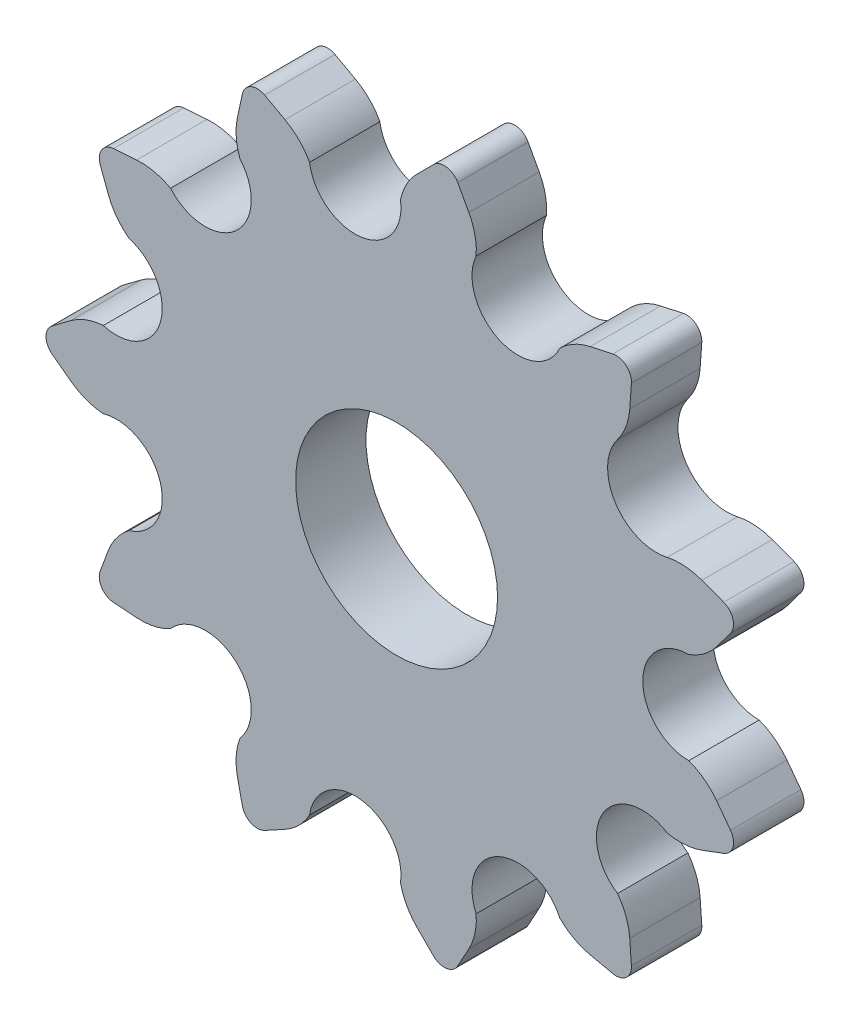
from build123d import *

# Parameters (mm, degrees)
SKETCH1_R           = 4.191
BOSS_EXTRUDE1_DEPTH = 2.921


with BuildPart() as part:
    # Sketch1 → Boss-Extrude1 (new body)
    with BuildSketch(Plane.XY):
        with BuildLine():
            Line((8.037087805, 10.932568983), (8.977813448, 11.137211321))
            ThreePointArc((8.977813448, 11.137211321), (9.528628972, 10.996624041), (9.746174499, 10.471422679))
            Line((9.746174499, 10.471422679), (9.677494343, 9.511148627))
            ThreePointArc((9.677494343, 9.511148627), (9.521666859, 8.798964182), (9.169962135, 8.160377715))
            ThreePointArc((9.169962135, 8.160377715), (9.081331887, 5.836217624), (11.232280603, 4.95134754))
            ThreePointArc((11.232280603, 4.95134754), (11.959262708, 5.005991004), (12.671821542, 4.851884559))
            Line((12.671821542, 4.851884559), (13.573848312, 4.515445968))
            ThreePointArc((13.573848312, 4.515445968), (13.961216597, 4.099383066), (13.860282246, 3.539941575))
            Line((13.860282246, 3.539941575), (13.283341474, 2.769238931))
            ThreePointArc((13.283341474, 2.769238931), (12.767215072, 2.254357949), (12.126096321, 1.907290757))
            ThreePointArc((12.126096321, 1.907290757), (10.218805564, 0), (12.126096321, -1.907290757))
            ThreePointArc((12.126096321, -1.907290757), (12.767215072, -2.254357949), (13.283341474, -2.769238931))
            Line((13.283341474, -2.769238931), (13.860282246, -3.539941575))
            ThreePointArc((13.860282246, -3.539941575), (13.961216597, -4.099383066), (13.573848312, -4.515445968))
            Line((13.573848312, -4.515445968), (12.671821542, -4.851884559))
            ThreePointArc((12.671821542, -4.851884559), (11.959262708, -5.005991004), (11.232280603, -4.95134754))
            ThreePointArc((11.232280603, -4.95134754), (8.596606282, -5.524703393), (9.169962135, -8.160377715))
            ThreePointArc((9.169962135, -8.160377715), (9.521666859, -8.798964182), (9.677494343, -9.511148627))
            Line((9.677494343, -9.511148627), (9.746174499, -10.471422679))
            ThreePointArc((9.746174499, -10.471422679), (9.528628972, -10.996624041), (8.977813448, -11.137211321))
            Line((8.977813448, -11.137211321), (8.037087805, -10.932568983))
            ThreePointArc((8.037087805, -10.932568983), (7.354328934, -10.676973184), (6.772295158, -10.237967978))
            ThreePointArc((6.772295158, -10.237967978), (4.245045246, -9.295352495), (3.302429764, -11.822602407))
            ThreePointArc((3.302429764, -11.822602407), (3.253056696, -12.549961458), (2.999111137, -13.233335836))
            Line((2.999111137, -13.233335836), (2.537725212, -14.078301071))
            ThreePointArc((2.537725212, -14.078301071), (2.070768976, -14.40251458), (1.531386247, -14.222990771))
            Line((1.531386247, -14.222990771), (0.850635478, -13.542240001))
            ThreePointArc((0.850635478, -13.542240001), (0.414447687, -12.958091818), (0.162153851, -12.27410592))
            ThreePointArc((0.162153851, -12.27410592), (-1.454287661, -10.114792857), (-3.613600724, -11.731234369))
            ThreePointArc((-3.613600724, -11.731234369), (-4.048375984, -12.316434644), (-4.631468665, -12.75403242))
            Line((-4.631468665, -12.75403242), (-5.4764339, -13.215418345))
            ThreePointArc((-5.4764339, -13.215418345), (-6.04454554, -13.235708504), (-6.401245266, -12.793071146))
            Line((-6.401245266, -12.793071146), (-6.605887604, -11.852345504))
            ThreePointArc((-6.605887604, -11.852345504), (-6.657017772, -11.125107857), (-6.499470159, -10.413301958))
            ThreePointArc((-6.499470159, -10.413301958), (-6.691894511, -7.722857955), (-9.382338515, -7.915282308))
            ThreePointArc((-9.382338515, -7.915282308), (-10.064477893, -8.172526855), (-10.79158989, -8.225413826))
            Line((-10.79158989, -8.225413826), (-11.751863943, -8.15673367))
            ThreePointArc((-11.751863943, -8.15673367), (-12.240759555, -7.866658497), (-12.301526637, -7.301441824))
            Line((-12.301526637, -7.301441824), (-11.965088046, -6.399415053))
            ThreePointArc((-11.965088046, -6.399415053), (-11.614927125, -5.759980758), (-11.097558316, -5.246348201))
            ThreePointArc((-11.097558316, -5.246348201), (-9.804872137, -2.878970219), (-12.172250119, -1.586284041))
            ThreePointArc((-12.172250119, -1.586284041), (-12.885179183, -1.433899534), (-13.525457575, -1.08528446))
            Line((-13.525457575, -1.08528446), (-14.296160219, -0.508343688))
            ThreePointArc((-14.296160219, -0.508343688), (-14.5506189, 0), (-14.296160219, 0.508343688))
            Line((-14.296160219, 0.508343688), (-13.525457575, 1.08528446))
            ThreePointArc((-13.525457575, 1.08528446), (-12.885179183, 1.433899534), (-12.172250119, 1.586284041))
            ThreePointArc((-12.172250119, 1.586284041), (-9.804872137, 2.878970219), (-11.097558316, 5.246348201))
            ThreePointArc((-11.097558316, 5.246348201), (-11.614927125, 5.759980758), (-11.965088046, 6.399415053))
            Line((-11.965088046, 6.399415053), (-12.301526637, 7.301441824))
            ThreePointArc((-12.301526637, 7.301441824), (-12.240759555, 7.866658497), (-11.751863943, 8.15673367))
            Line((-11.751863943, 8.15673367), (-10.79158989, 8.225413826))
            ThreePointArc((-10.79158989, 8.225413826), (-10.064477893, 8.172526855), (-9.382338515, 7.915282308))
            ThreePointArc((-9.382338515, 7.915282308), (-6.691894511, 7.722857955), (-6.499470159, 10.413301958))
            ThreePointArc((-6.499470159, 10.413301958), (-6.657017772, 11.125107857), (-6.605887604, 11.852345504))
            Line((-6.605887604, 11.852345504), (-6.401245266, 12.793071146))
            ThreePointArc((-6.401245266, 12.793071146), (-6.04454554, 13.235708504), (-5.4764339, 13.215418345))
            Line((-5.4764339, 13.215418345), (-4.631468665, 12.75403242))
            ThreePointArc((-4.631468665, 12.75403242), (-4.048375984, 12.316434644), (-3.613600724, 11.731234369))
            ThreePointArc((-3.613600724, 11.731234369), (-1.454287661, 10.114792857), (0.162153851, 12.27410592))
            ThreePointArc((0.162153851, 12.27410592), (0.414447687, 12.958091818), (0.850635478, 13.542240001))
            Line((0.850635478, 13.542240001), (1.531386247, 14.222990771))
            ThreePointArc((1.531386247, 14.222990771), (2.070768976, 14.40251458), (2.537725212, 14.078301071))
            Line((2.537725212, 14.078301071), (2.999111137, 13.233335836))
            ThreePointArc((2.999111137, 13.233335836), (3.253056696, 12.549961458), (3.302429764, 11.822602407))
            ThreePointArc((3.302429764, 11.822602407), (4.245045246, 9.295352495), (6.772295158, 10.237967978))
            ThreePointArc((6.772295158, 10.237967978), (7.354328934, 10.676973184), (8.037087805, 10.932568983))
        make_face()
        Circle(SKETCH1_R, mode=Mode.SUBTRACT)
    extrude(amount=BOSS_EXTRUDE1_DEPTH)


solid = part.part
